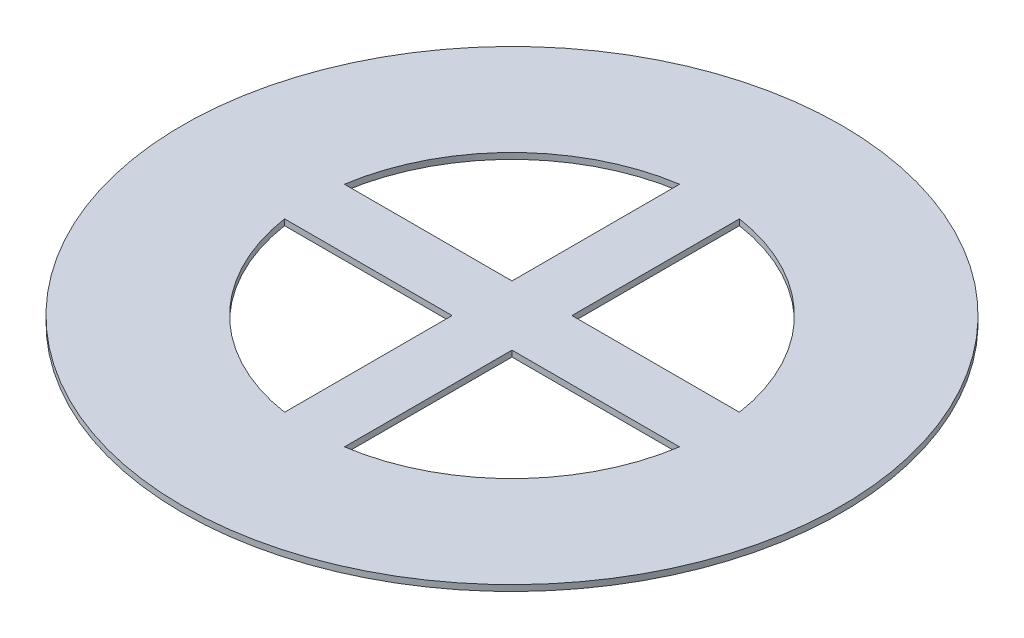
from build123d import *

# Parameters (mm, degrees)
SKETCH_1_R      = 165
EXTRUDE_1_DEPTH = 3


with BuildPart() as part:
    # 草图1 → 凸台-拉伸1 (new body)
    with BuildSketch(Plane(origin=(0, 0, 0), x_dir=(1, 0, 0), z_dir=(0, 1, 0))):
        with Locations(Location((0, 0, 0), (0, 0, 270))):
            Circle(SKETCH_1_R)
        with BuildLine():
            Line((-15, 98.868599666), (-15, 15))
            Line((-15, 15), (-98.868599666, 15))
            ThreePointArc((-98.868599666, 15), (-70.710678119, 70.710678119), (-15, 98.868599666))
        make_face(mode=Mode.SUBTRACT)
        with BuildLine():
            Line((15, 98.868599666), (15, 15))
            Line((15, 15), (98.868599666, 15))
            ThreePointArc((98.868599666, 15), (70.710678119, 70.710678119), (15, 98.868599666))
        make_face(mode=Mode.SUBTRACT)
        with BuildLine():
            Line((-98.868599666, -15), (-15, -15))
            Line((-15, -15), (-15, -98.868599666))
            ThreePointArc((-15, -98.868599666), (-70.710678119, -70.710678119), (-98.868599666, -15))
        make_face(mode=Mode.SUBTRACT)
        with BuildLine():
            Line((15, -15), (15, -98.868599666))
            ThreePointArc((15, -98.868599666), (70.710678119, -70.710678119), (98.868599666, -15))
            Line((98.868599666, -15), (15, -15))
        make_face(mode=Mode.SUBTRACT)
    extrude(amount=EXTRUDE_1_DEPTH)


solid = part.part
